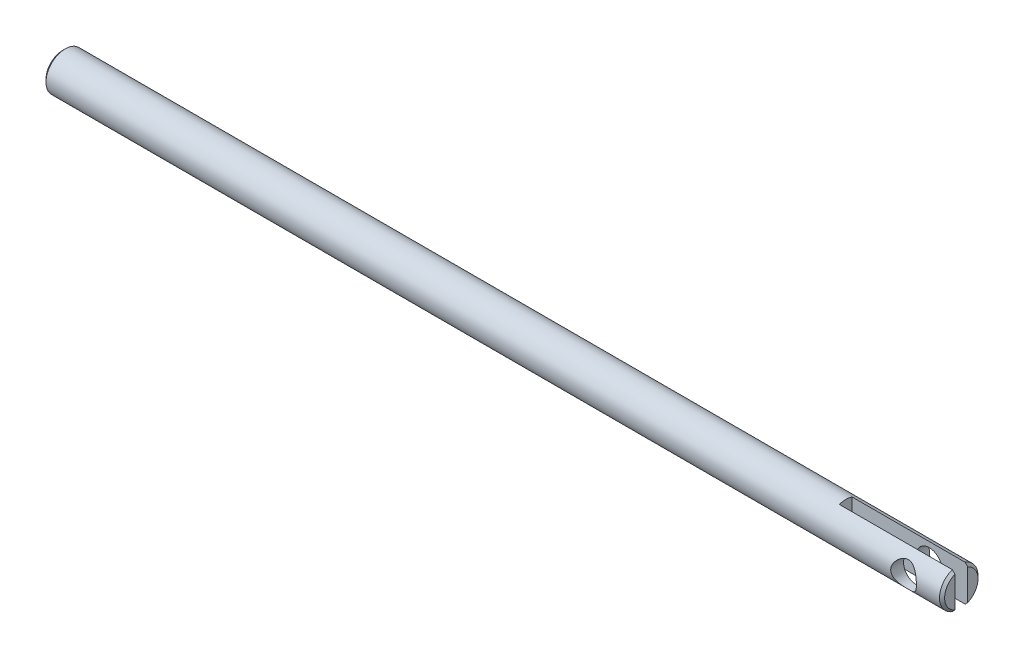
from build123d import *

# Parameters (mm, degrees)
CUT_EXTRUDE1_DEPTH      = 71.032135481
CUT_EXTRUDE1_DEPTH_BACK = 71.032135481
SKETCH2_R               = 1
CHAMFER1_SIZE           = 0.2
CUT_EXTRUDE2_DEPTH      = 71.032135485
CUT_EXTRUDE2_DEPTH_BACK = 71.032135485
SKETCH3_W               = 9
SKETCH3_H               = 1


with BuildPart() as part:
    # Sketch1 → Revolve1 (revolve)
    with BuildSketch(Plane.XY):
        Polygon((-70, 0), (-70, 1.5), (0, 1.5), (0, 0.5), (0, 0), (-9, 0), align=None)
    revolve(axis=Axis((0, 0, 0), (-1, 0, 0)))

    # Sketch2 → Cut-Extrude1 (cut, two sides: drawn at the far end of the back side and taken through both)
    with BuildSketch(Plane.XY.offset(-CUT_EXTRUDE1_DEPTH_BACK)):
        with Locations((-3, 0)):
            Circle(SKETCH2_R)
    extrude(amount=CUT_EXTRUDE1_DEPTH + CUT_EXTRUDE1_DEPTH_BACK, mode=Mode.SUBTRACT)

    # Chamfer1
    chamfer1_edges = [part.edges().sort_by_distance(p)[0] for p in [
        (0, -1.5, 0),
        (-70, -1.5, 0),
    ]]
    chamfer(chamfer1_edges, length=CHAMFER1_SIZE)

    # Sketch3 → Cut-Extrude2 (cut, two sides: drawn at the far end of the back side and taken through both)
    with BuildSketch(Plane(origin=(0, 0, 0), x_dir=(1, 0, 0), z_dir=(0, 1, 0)).offset(-CUT_EXTRUDE2_DEPTH_BACK)):
        with Locations((-4.5, 0)):
            Rectangle(SKETCH3_W, SKETCH3_H)
    extrude(amount=CUT_EXTRUDE2_DEPTH + CUT_EXTRUDE2_DEPTH_BACK, mode=Mode.SUBTRACT)


solid = part.part
